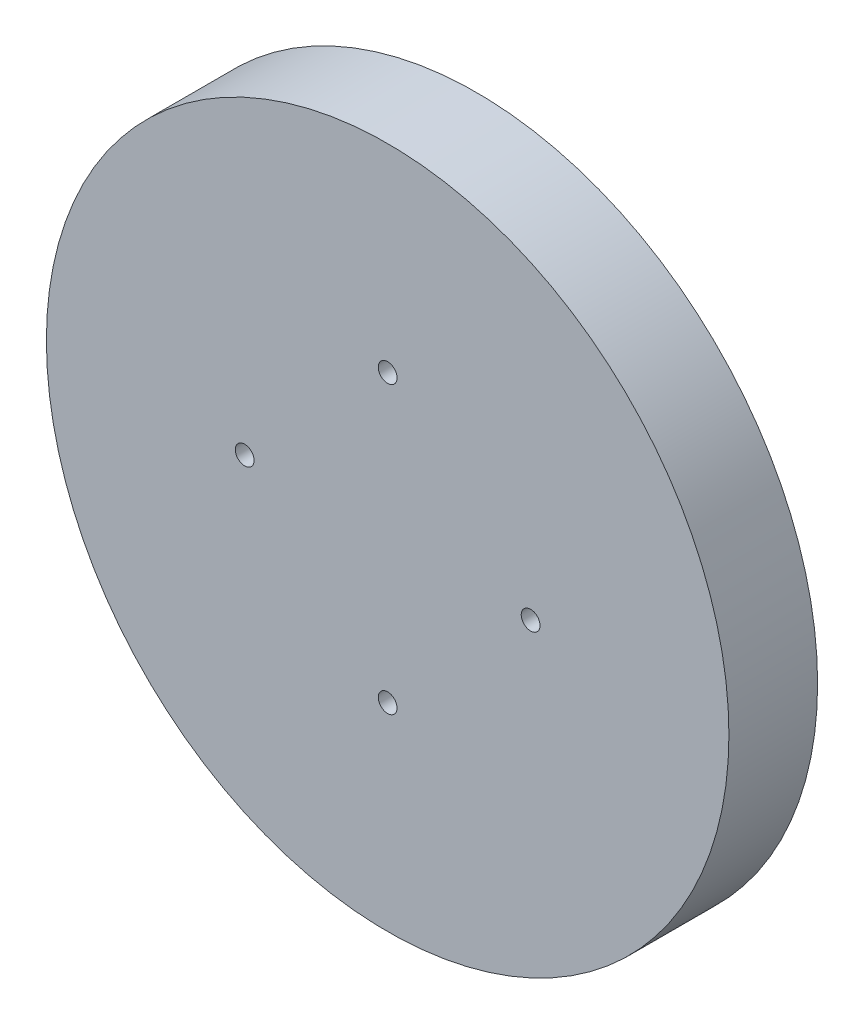
from build123d import *

# Parameters (mm, degrees)
ESQUISSE1_R                  = 19.24
BOSS_EXTRU_1_DEPTH           = 5
ESQUISSE2_R                  = 0.53
ENL_V_MAT_EXTRU_1_DEPTH      = 5
R_P_TITION_CIRCULAIRE1_COUNT = 4


with BuildPart() as part:
    # Esquisse1 → Boss.-Extru.1 (new body)
    with BuildSketch(Plane.XY):
        Circle(ESQUISSE1_R)
    extrude(amount=BOSS_EXTRU_1_DEPTH)

    # Esquisse2 → Enlèv. mat.-Extru.1 (cut)
    with BuildSketch(Plane.XY.offset(5)):
        with Locations((0, 8.06)):
            Circle(ESQUISSE2_R)
    enl_v_mat_extru_1 = extrude(amount=-ENL_V_MAT_EXTRU_1_DEPTH, mode=Mode.SUBTRACT)

    # Répétition circulaire1: Enlèv. mat.-Extru.1 ×4 about axis
    r_p_tition_circulaire1_axis = Axis((0, 0, 0), (0, 0, 1))
    for i in range(1, R_P_TITION_CIRCULAIRE1_COUNT):
        add(enl_v_mat_extru_1.rotate(r_p_tition_circulaire1_axis, i * 360 / R_P_TITION_CIRCULAIRE1_COUNT), mode=Mode.SUBTRACT)


solid = part.part
